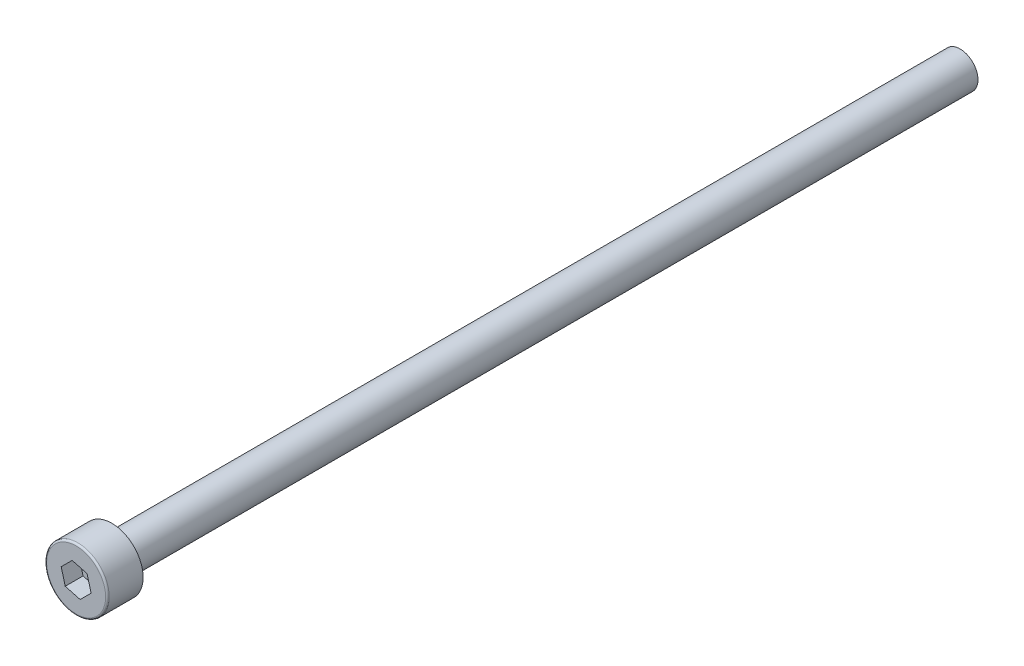
from build123d import *

# Parameters (mm, degrees)
SKETCH_1_R          = 3.5
EXTRUDE_1_DEPTH     = 4
CUT_EXTRUDE_1_DEPTH = 2
SKETCH_3_R          = 2
EXTRUDE_2_DEPTH     = 95
FILLET_1_R          = 0.2


with BuildPart() as part:
    # 草图1 → 凸台-拉伸1 (new body)
    with BuildSketch(Plane.XY):
        Circle(SKETCH_1_R)
    extrude(amount=EXTRUDE_1_DEPTH)

    # 草图2 → 切除-拉伸1 (cut)
    with BuildSketch(Plane.XY.offset(4)):
        Polygon((-1.224744871, -1.224744871), (0.448287736, -1.673032607), (1.673032607, -0.448287736), (1.224744871, 1.224744871), (-0.448287736, 1.673032607), (-1.673032607, 0.448287736), align=None)
    extrude(amount=-CUT_EXTRUDE_1_DEPTH, mode=Mode.SUBTRACT)

    # 草图3 → 凸台-拉伸2 (add)
    with BuildSketch(Plane(origin=(0, 0, 0), x_dir=(-1, 0, 0), z_dir=(0, 0, -1))):
        with Locations(Location((0, 0, 0), (0, 0, 180))):
            Circle(SKETCH_3_R)
    extrude(amount=EXTRUDE_2_DEPTH)

    # 圆角1
    fillet_1_edges = [part.edges().sort_by_distance(p)[0] for p in [
        (-3.5, 0, 4),
    ]]
    fillet(fillet_1_edges, radius=FILLET_1_R)


solid = part.part
